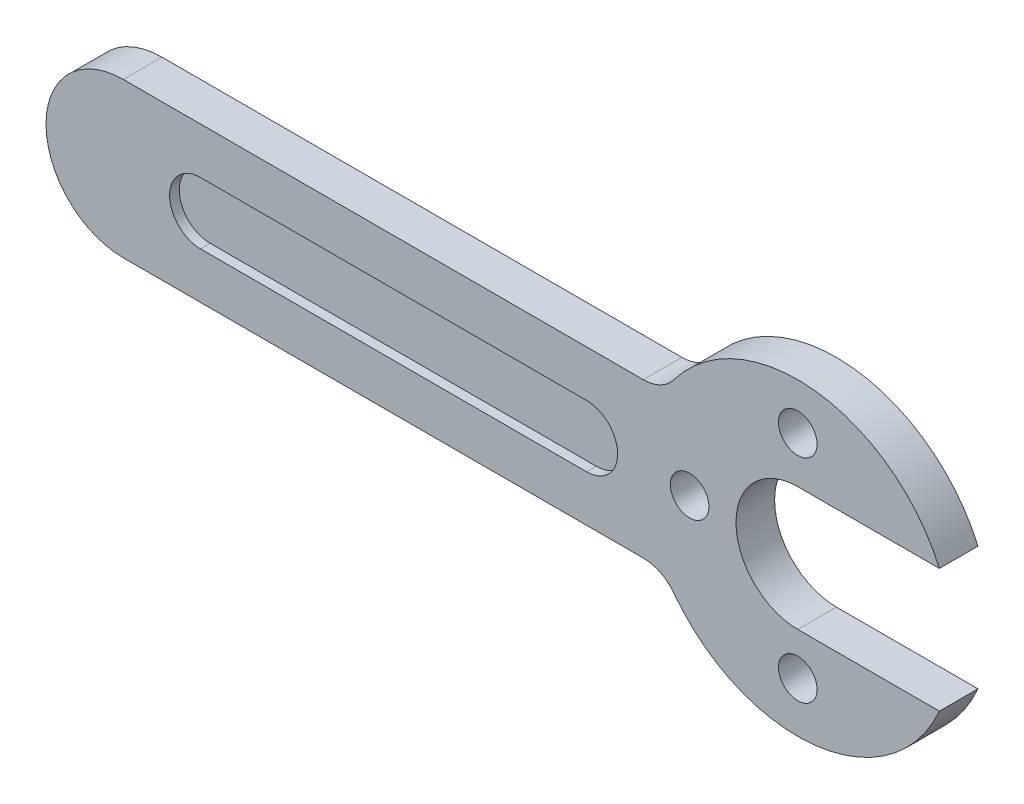
from build123d import *

# Parameters (mm, degrees)
SKETCH1_R           = 5
BOSS_EXTRUDE1_DEPTH = 5
BOSS_EXTRUDE2_DEPTH = 2.5


with BuildPart() as part:
    # Sketch1 → Boss-Extrude1 (new, symmetric)
    with BuildSketch(Plane.XY):
        with BuildLine():
            Line((0, 16), (36.66060556, 16))
            ThreePointArc((36.66060556, 16), (4.629288395, 39.731218065), (-32, 24))
            ThreePointArc((-32, 24), (-35.527864045, 21.05572809), (-40, 20))
            Line((-40, 20), (-174.641016151, 20))
            ThreePointArc((-174.641016151, 20), (-194.641016151, 0), (-174.641016151, -20))
            Line((-174.641016151, -20), (-40, -20))
            ThreePointArc((-40, -20), (-35.527864045, -21.05572809), (-32, -24))
            ThreePointArc((-32, -24), (4.629288395, -39.731218065), (36.66060556, -16))
            Line((36.66060556, -16), (0, -16))
            ThreePointArc((0, -16), (-16, 0), (0, 16))
        make_face()
        with Locations((0, 28)):
            Circle(SKETCH1_R, mode=Mode.SUBTRACT)
        with Locations((0, -27)):
            Circle(SKETCH1_R, mode=Mode.SUBTRACT)
        with Locations((-28, 0)):
            Circle(SKETCH1_R, mode=Mode.SUBTRACT)
        with BuildLine():
            Line((-154.641016151, 8), (-54.641016151, 8))
            ThreePointArc((-54.641016151, 8), (-46.641016151, 0), (-54.641016151, -8))
            Line((-54.641016151, -8), (-154.641016151, -8))
            ThreePointArc((-154.641016151, -8), (-162.641016151, 0), (-154.641016151, 8))
        make_face(mode=Mode.SUBTRACT)
    extrude(amount=BOSS_EXTRUDE1_DEPTH, both=True)

    # Sketch1<2> → Boss-Extrude2 (add, symmetric)
    with BuildSketch(Plane.XY):
        with BuildLine():
            Line((-54.641016151, 8), (-154.641016151, 8))
            ThreePointArc((-154.641016151, 8), (-162.641016151, 0), (-154.641016151, -8))
            Line((-154.641016151, -8), (-54.641016151, -8))
            ThreePointArc((-54.641016151, -8), (-46.641016151, 0), (-54.641016151, 8))
        make_face()
    extrude(amount=BOSS_EXTRUDE2_DEPTH, both=True)


solid = part.part
